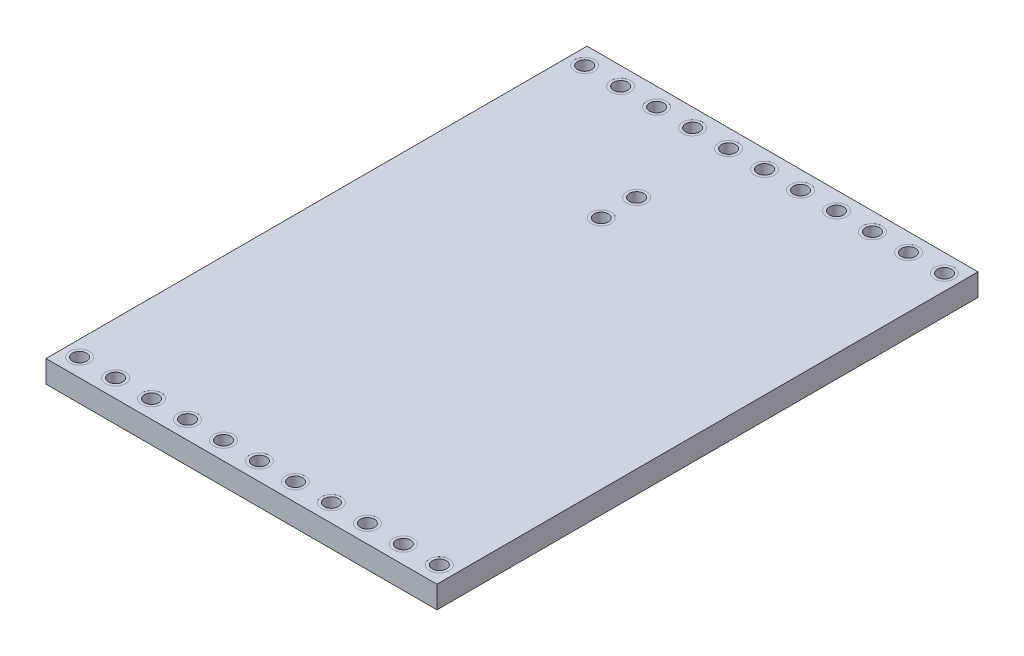
from build123d import *

# Parameters (mm, degrees)
BASES_W                           = 27.6
BASES_H                           = 38.2
BASE_DEPTH                        = 0.785
F_1_0_1_DIAMETER_HOLE1_D          = 1
SOLDERACCESSCUTS_R                = 0.7
SOLDERACCESSCUT_DEPTH             = 0.001
HOLESACHORZLP_COUNT               = 11
HOLESACHORZLP_PITCH               = 2.54
HOLESACHORZLP_COPY_1_SKETCH_R     = 0.7
HOLESACHORZLP_COPY_1_DEPTH        = 0.001
HOLESACHORZLP_COPY_2_SKETCH_R     = 0.7
HOLESACHORZLP_COPY_2_DEPTH        = 0.001
HOLESACHORZLP_COPY_3_SKETCH_R     = 0.7
HOLESACHORZLP_COPY_3_DEPTH        = 0.001
HOLESACHORZLP_COPY_4_SKETCH_R     = 0.7
HOLESACHORZLP_COPY_4_DEPTH        = 0.001
HOLESACHORZLP_COPY_5_SKETCH_R     = 0.7
HOLESACHORZLP_COPY_5_DEPTH        = 0.001
HOLESACHORZLP_COPY_6_SKETCH_R     = 0.7
HOLESACHORZLP_COPY_6_DEPTH        = 0.001
HOLESACHORZLP_COPY_7_SKETCH_R     = 0.7
HOLESACHORZLP_COPY_7_DEPTH        = 0.001
HOLESACHORZLP_COPY_8_SKETCH_R     = 0.7
HOLESACHORZLP_COPY_8_DEPTH        = 0.001
HOLESACHORZLP_COPY_9_SKETCH_R     = 0.7
HOLESACHORZLP_COPY_9_DEPTH        = 0.001
HOLESACHORZLP_COPY_10_SKETCH_R    = 0.7
HOLESACHORZLP_COPY_10_DEPTH       = 0.001
MIRROR1_COPY_1_SKETCH_R           = 0.7
MIRROR1_COPY_1_DEPTH              = 0.001
MIRROR1_COPY_2_D                  = 1
MIRROR1_COPY_3_D                  = 1
MIRROR1_COPY_4_D                  = 1
MIRROR1_COPY_5_D                  = 1
MIRROR1_COPY_6_D                  = 1
MIRROR1_COPY_7_D                  = 1
MIRROR1_COPY_8_D                  = 1
MIRROR1_COPY_9_D                  = 1
MIRROR1_COPY_10_D                 = 1
MIRROR1_COPY_11_D                 = 1
MIRROR1_COPY_12_SKETCH_R          = 0.7
MIRROR1_COPY_12_DEPTH             = 0.001
MIRROR1_COPY_13_SKETCH_R          = 0.7
MIRROR1_COPY_13_DEPTH             = 0.001
MIRROR1_COPY_14_SKETCH_R          = 0.7
MIRROR1_COPY_14_DEPTH             = 0.001
MIRROR1_COPY_15_SKETCH_R          = 0.7
MIRROR1_COPY_15_DEPTH             = 0.001
MIRROR1_COPY_16_SKETCH_R          = 0.7
MIRROR1_COPY_16_DEPTH             = 0.001
MIRROR1_COPY_17_SKETCH_R          = 0.7
MIRROR1_COPY_17_DEPTH             = 0.001
MIRROR1_COPY_18_SKETCH_R          = 0.7
MIRROR1_COPY_18_DEPTH             = 0.001
MIRROR1_COPY_19_SKETCH_R          = 0.7
MIRROR1_COPY_19_DEPTH             = 0.001
MIRROR1_COPY_20_SKETCH_R          = 0.7
MIRROR1_COPY_20_DEPTH             = 0.001
MIRROR1_COPY_21_SKETCH_R          = 0.7
MIRROR1_COPY_21_DEPTH             = 0.001
MIRROR1_COPY_22_SKETCH_R          = 0.7
MIRROR1_COPY_22_DEPTH             = 0.001
MIRROR1_COPY_23_SKETCH_R          = 0.7
MIRROR1_COPY_23_DEPTH             = 0.001
MIRROR1_COPY_24_SKETCH_R          = 0.7
MIRROR1_COPY_24_DEPTH             = 0.001
MIRROR1_COPY_25_SKETCH_R          = 0.7
MIRROR1_COPY_25_DEPTH             = 0.001
MIRROR1_COPY_26_SKETCH_R          = 0.7
MIRROR1_COPY_26_DEPTH             = 0.001
MIRROR1_COPY_27_SKETCH_R          = 0.7
MIRROR1_COPY_27_DEPTH             = 0.001
MIRROR1_COPY_28_SKETCH_R          = 0.7
MIRROR1_COPY_28_DEPTH             = 0.001
MIRROR1_COPY_29_SKETCH_R          = 0.7
MIRROR1_COPY_29_DEPTH             = 0.001
MIRROR1_COPY_30_SKETCH_R          = 0.7
MIRROR1_COPY_30_DEPTH             = 0.001
MIRROR1_COPY_31_SKETCH_R          = 0.7
MIRROR1_COPY_31_DEPTH             = 0.001
F_1_0_1_DIAMETER_HOLE2_D          = 1
SOLDERACCESSCUTFORCAPACITOR_START = -0.001
SOLDERACCESSCUTFORCAPACITORS_R    = 0.7
SOLDERACCESSCUTFORCAPACITORS_R_2  = 0.5
SOLDERACCESSCUTFORCAPACITOR_DEPTH = 0.001


with BuildPart() as part:
    # BaseS → Base (new, symmetric)
    with BuildSketch(Plane(origin=(0, 0, 0), x_dir=(1, 0, 0), z_dir=(0, 1, 0))):
        Rectangle(BASES_W, BASES_H)
    extrude(amount=BASE_DEPTH, both=True)

    # Ø1.0 (1) Diameter Hole1 (through all)
    with Locations(Plane(origin=(0, 0.785, 0), x_dir=(1, 0, 0), z_dir=(0, 1, 0))):
        with Locations((-12.7, -17.83)):
            f_1_0_1_diameter_hole1 = Hole(F_1_0_1_DIAMETER_HOLE1_D / 2)

    # SolderAccessCutS → SolderAccessCut (cut)
    with BuildSketch(Plane(origin=(0, 0.785, 0), x_dir=(1, 0, 0), z_dir=(0, 1, 0))):
        with Locations(Location((-12.7, -17.83, 0), (0, 0, 270))):
            Circle(SOLDERACCESSCUTS_R)
    solderaccesscut = extrude(amount=-SOLDERACCESSCUT_DEPTH, mode=Mode.SUBTRACT)

    # SACVM: SolderAccessCut across plane
    add(solderaccesscut.mirror(Plane.ZX), mode=Mode.SUBTRACT)

    # HoleSACHorzLP: Ø1.0 (1) Diameter Hole1, SolderAccessCut ×11
    with Locations(*[(i * HOLESACHORZLP_PITCH, 0, 0) for i in range(1, HOLESACHORZLP_COUNT)]):
        add(f_1_0_1_diameter_hole1, mode=Mode.SUBTRACT)
        add(solderaccesscut, mode=Mode.SUBTRACT)

    # HoleSACHorzLP copy 1 sketch → HoleSACHorzLP copy 1 (cut)
    with BuildSketch(Plane(origin=(2.54, -0.785, 0), x_dir=(1, 0, 0), z_dir=(0, -1, 0))):
        with Locations((-12.7, 17.83)):
            Circle(HOLESACHORZLP_COPY_1_SKETCH_R)
    extrude(amount=-HOLESACHORZLP_COPY_1_DEPTH, mode=Mode.SUBTRACT)

    # HoleSACHorzLP copy 2 sketch → HoleSACHorzLP copy 2 (cut)
    with BuildSketch(Plane(origin=(5.08, -0.785, 0), x_dir=(1, 0, 0), z_dir=(0, -1, 0))):
        with Locations((-12.7, 17.83)):
            Circle(HOLESACHORZLP_COPY_2_SKETCH_R)
    extrude(amount=-HOLESACHORZLP_COPY_2_DEPTH, mode=Mode.SUBTRACT)

    # HoleSACHorzLP copy 3 sketch → HoleSACHorzLP copy 3 (cut)
    with BuildSketch(Plane(origin=(7.62, -0.785, 0), x_dir=(1, 0, 0), z_dir=(0, -1, 0))):
        with Locations((-12.7, 17.83)):
            Circle(HOLESACHORZLP_COPY_3_SKETCH_R)
    extrude(amount=-HOLESACHORZLP_COPY_3_DEPTH, mode=Mode.SUBTRACT)

    # HoleSACHorzLP copy 4 sketch → HoleSACHorzLP copy 4 (cut)
    with BuildSketch(Plane(origin=(10.16, -0.785, 0), x_dir=(1, 0, 0), z_dir=(0, -1, 0))):
        with Locations((-12.7, 17.83)):
            Circle(HOLESACHORZLP_COPY_4_SKETCH_R)
    extrude(amount=-HOLESACHORZLP_COPY_4_DEPTH, mode=Mode.SUBTRACT)

    # HoleSACHorzLP copy 5 sketch → HoleSACHorzLP copy 5 (cut)
    with BuildSketch(Plane(origin=(12.7, -0.785, 0), x_dir=(1, 0, 0), z_dir=(0, -1, 0))):
        with Locations((-12.7, 17.83)):
            Circle(HOLESACHORZLP_COPY_5_SKETCH_R)
    extrude(amount=-HOLESACHORZLP_COPY_5_DEPTH, mode=Mode.SUBTRACT)

    # HoleSACHorzLP copy 6 sketch → HoleSACHorzLP copy 6 (cut)
    with BuildSketch(Plane(origin=(15.24, -0.785, 0), x_dir=(1, 0, 0), z_dir=(0, -1, 0))):
        with Locations((-12.7, 17.83)):
            Circle(HOLESACHORZLP_COPY_6_SKETCH_R)
    extrude(amount=-HOLESACHORZLP_COPY_6_DEPTH, mode=Mode.SUBTRACT)

    # HoleSACHorzLP copy 7 sketch → HoleSACHorzLP copy 7 (cut)
    with BuildSketch(Plane(origin=(17.78, -0.785, 0), x_dir=(1, 0, 0), z_dir=(0, -1, 0))):
        with Locations((-12.7, 17.83)):
            Circle(HOLESACHORZLP_COPY_7_SKETCH_R)
    extrude(amount=-HOLESACHORZLP_COPY_7_DEPTH, mode=Mode.SUBTRACT)

    # HoleSACHorzLP copy 8 sketch → HoleSACHorzLP copy 8 (cut)
    with BuildSketch(Plane(origin=(20.32, -0.785, 0), x_dir=(1, 0, 0), z_dir=(0, -1, 0))):
        with Locations((-12.7, 17.83)):
            Circle(HOLESACHORZLP_COPY_8_SKETCH_R)
    extrude(amount=-HOLESACHORZLP_COPY_8_DEPTH, mode=Mode.SUBTRACT)

    # HoleSACHorzLP copy 9 sketch → HoleSACHorzLP copy 9 (cut)
    with BuildSketch(Plane(origin=(22.86, -0.785, 0), x_dir=(1, 0, 0), z_dir=(0, -1, 0))):
        with Locations((-12.7, 17.83)):
            Circle(HOLESACHORZLP_COPY_9_SKETCH_R)
    extrude(amount=-HOLESACHORZLP_COPY_9_DEPTH, mode=Mode.SUBTRACT)

    # HoleSACHorzLP copy 10 sketch → HoleSACHorzLP copy 10 (cut)
    with BuildSketch(Plane(origin=(25.4, -0.785, 0), x_dir=(1, 0, 0), z_dir=(0, -1, 0))):
        with Locations((-12.7, 17.83)):
            Circle(HOLESACHORZLP_COPY_10_SKETCH_R)
    extrude(amount=-HOLESACHORZLP_COPY_10_DEPTH, mode=Mode.SUBTRACT)

    # Mirror1: Ø1.0 (1) Diameter Hole1, SolderAccessCut across plane
    add(f_1_0_1_diameter_hole1.mirror(Plane.XY), mode=Mode.SUBTRACT)
    add(solderaccesscut.mirror(Plane.XY), mode=Mode.SUBTRACT)

    # Mirror1 copy 1 sketch → Mirror1 copy 1 (cut)
    with BuildSketch(Plane.XZ.offset(0.785)):
        with Locations(Location((-12.7, -17.83, 0), (0, 0, 270))):
            Circle(MIRROR1_COPY_1_SKETCH_R)
    extrude(amount=-MIRROR1_COPY_1_DEPTH, mode=Mode.SUBTRACT)

    # Mirror1 copy 2 (through all)
    with Locations(Plane(origin=(2.54, 0.785, 0), x_dir=(1, 0, 0), z_dir=(0, 1, 0))):
        with Locations((-12.7, 17.83)):
            Hole(MIRROR1_COPY_2_D / 2)

    # Mirror1 copy 3 (through all)
    with Locations(Plane(origin=(5.08, 0.785, 0), x_dir=(1, 0, 0), z_dir=(0, 1, 0))):
        with Locations((-12.7, 17.83)):
            Hole(MIRROR1_COPY_3_D / 2)

    # Mirror1 copy 4 (through all)
    with Locations(Plane(origin=(7.62, 0.785, 0), x_dir=(1, 0, 0), z_dir=(0, 1, 0))):
        with Locations((-12.7, 17.83)):
            Hole(MIRROR1_COPY_4_D / 2)

    # Mirror1 copy 5 (through all)
    with Locations(Plane(origin=(10.16, 0.785, 0), x_dir=(1, 0, 0), z_dir=(0, 1, 0))):
        with Locations((-12.7, 17.83)):
            Hole(MIRROR1_COPY_5_D / 2)

    # Mirror1 copy 6 (through all)
    with Locations(Plane(origin=(12.7, 0.785, 0), x_dir=(1, 0, 0), z_dir=(0, 1, 0))):
        with Locations((-12.7, 17.83)):
            Hole(MIRROR1_COPY_6_D / 2)

    # Mirror1 copy 7 (through all)
    with Locations(Plane(origin=(15.24, 0.785, 0), x_dir=(1, 0, 0), z_dir=(0, 1, 0))):
        with Locations((-12.7, 17.83)):
            Hole(MIRROR1_COPY_7_D / 2)

    # Mirror1 copy 8 (through all)
    with Locations(Plane(origin=(17.78, 0.785, 0), x_dir=(1, 0, 0), z_dir=(0, 1, 0))):
        with Locations((-12.7, 17.83)):
            Hole(MIRROR1_COPY_8_D / 2)

    # Mirror1 copy 9 (through all)
    with Locations(Plane(origin=(20.32, 0.785, 0), x_dir=(1, 0, 0), z_dir=(0, 1, 0))):
        with Locations((-12.7, 17.83)):
            Hole(MIRROR1_COPY_9_D / 2)

    # Mirror1 copy 10 (through all)
    with Locations(Plane(origin=(22.86, 0.785, 0), x_dir=(1, 0, 0), z_dir=(0, 1, 0))):
        with Locations((-12.7, 17.83)):
            Hole(MIRROR1_COPY_10_D / 2)

    # Mirror1 copy 11 (through all)
    with Locations(Plane(origin=(25.4, 0.785, 0), x_dir=(1, 0, 0), z_dir=(0, 1, 0))):
        with Locations((-12.7, 17.83)):
            Hole(MIRROR1_COPY_11_D / 2)

    # Mirror1 copy 12 sketch → Mirror1 copy 12 (cut)
    with BuildSketch(Plane(origin=(2.54, 0.785, 0), x_dir=(1, 0, 0), z_dir=(0, 1, 0))):
        with Locations((-12.7, 17.83)):
            Circle(MIRROR1_COPY_12_SKETCH_R)
    extrude(amount=-MIRROR1_COPY_12_DEPTH, mode=Mode.SUBTRACT)

    # Mirror1 copy 13 sketch → Mirror1 copy 13 (cut)
    with BuildSketch(Plane(origin=(5.08, 0.785, 0), x_dir=(1, 0, 0), z_dir=(0, 1, 0))):
        with Locations((-12.7, 17.83)):
            Circle(MIRROR1_COPY_13_SKETCH_R)
    extrude(amount=-MIRROR1_COPY_13_DEPTH, mode=Mode.SUBTRACT)

    # Mirror1 copy 14 sketch → Mirror1 copy 14 (cut)
    with BuildSketch(Plane(origin=(7.62, 0.785, 0), x_dir=(1, 0, 0), z_dir=(0, 1, 0))):
        with Locations((-12.7, 17.83)):
            Circle(MIRROR1_COPY_14_SKETCH_R)
    extrude(amount=-MIRROR1_COPY_14_DEPTH, mode=Mode.SUBTRACT)

    # Mirror1 copy 15 sketch → Mirror1 copy 15 (cut)
    with BuildSketch(Plane(origin=(10.16, 0.785, 0), x_dir=(1, 0, 0), z_dir=(0, 1, 0))):
        with Locations((-12.7, 17.83)):
            Circle(MIRROR1_COPY_15_SKETCH_R)
    extrude(amount=-MIRROR1_COPY_15_DEPTH, mode=Mode.SUBTRACT)

    # Mirror1 copy 16 sketch → Mirror1 copy 16 (cut)
    with BuildSketch(Plane(origin=(12.7, 0.785, 0), x_dir=(1, 0, 0), z_dir=(0, 1, 0))):
        with Locations((-12.7, 17.83)):
            Circle(MIRROR1_COPY_16_SKETCH_R)
    extrude(amount=-MIRROR1_COPY_16_DEPTH, mode=Mode.SUBTRACT)

    # Mirror1 copy 17 sketch → Mirror1 copy 17 (cut)
    with BuildSketch(Plane(origin=(15.24, 0.785, 0), x_dir=(1, 0, 0), z_dir=(0, 1, 0))):
        with Locations((-12.7, 17.83)):
            Circle(MIRROR1_COPY_17_SKETCH_R)
    extrude(amount=-MIRROR1_COPY_17_DEPTH, mode=Mode.SUBTRACT)

    # Mirror1 copy 18 sketch → Mirror1 copy 18 (cut)
    with BuildSketch(Plane(origin=(17.78, 0.785, 0), x_dir=(1, 0, 0), z_dir=(0, 1, 0))):
        with Locations((-12.7, 17.83)):
            Circle(MIRROR1_COPY_18_SKETCH_R)
    extrude(amount=-MIRROR1_COPY_18_DEPTH, mode=Mode.SUBTRACT)

    # Mirror1 copy 19 sketch → Mirror1 copy 19 (cut)
    with BuildSketch(Plane(origin=(20.32, 0.785, 0), x_dir=(1, 0, 0), z_dir=(0, 1, 0))):
        with Locations((-12.7, 17.83)):
            Circle(MIRROR1_COPY_19_SKETCH_R)
    extrude(amount=-MIRROR1_COPY_19_DEPTH, mode=Mode.SUBTRACT)

    # Mirror1 copy 20 sketch → Mirror1 copy 20 (cut)
    with BuildSketch(Plane(origin=(22.86, 0.785, 0), x_dir=(1, 0, 0), z_dir=(0, 1, 0))):
        with Locations((-12.7, 17.83)):
            Circle(MIRROR1_COPY_20_SKETCH_R)
    extrude(amount=-MIRROR1_COPY_20_DEPTH, mode=Mode.SUBTRACT)

    # Mirror1 copy 21 sketch → Mirror1 copy 21 (cut)
    with BuildSketch(Plane(origin=(25.4, 0.785, 0), x_dir=(1, 0, 0), z_dir=(0, 1, 0))):
        with Locations((-12.7, 17.83)):
            Circle(MIRROR1_COPY_21_SKETCH_R)
    extrude(amount=-MIRROR1_COPY_21_DEPTH, mode=Mode.SUBTRACT)

    # Mirror1 copy 22 sketch → Mirror1 copy 22 (cut)
    with BuildSketch(Plane(origin=(2.54, -0.785, 0), x_dir=(1, 0, 0), z_dir=(0, -1, 0))):
        with Locations(Location((-12.7, -17.83, 0), (0, 0, 270))):
            Circle(MIRROR1_COPY_22_SKETCH_R)
    extrude(amount=-MIRROR1_COPY_22_DEPTH, mode=Mode.SUBTRACT)

    # Mirror1 copy 23 sketch → Mirror1 copy 23 (cut)
    with BuildSketch(Plane(origin=(5.08, -0.785, 0), x_dir=(1, 0, 0), z_dir=(0, -1, 0))):
        with Locations(Location((-12.7, -17.83, 0), (0, 0, 270))):
            Circle(MIRROR1_COPY_23_SKETCH_R)
    extrude(amount=-MIRROR1_COPY_23_DEPTH, mode=Mode.SUBTRACT)

    # Mirror1 copy 24 sketch → Mirror1 copy 24 (cut)
    with BuildSketch(Plane(origin=(7.62, -0.785, 0), x_dir=(1, 0, 0), z_dir=(0, -1, 0))):
        with Locations(Location((-12.7, -17.83, 0), (0, 0, 270))):
            Circle(MIRROR1_COPY_24_SKETCH_R)
    extrude(amount=-MIRROR1_COPY_24_DEPTH, mode=Mode.SUBTRACT)

    # Mirror1 copy 25 sketch → Mirror1 copy 25 (cut)
    with BuildSketch(Plane(origin=(10.16, -0.785, 0), x_dir=(1, 0, 0), z_dir=(0, -1, 0))):
        with Locations(Location((-12.7, -17.83, 0), (0, 0, 270))):
            Circle(MIRROR1_COPY_25_SKETCH_R)
    extrude(amount=-MIRROR1_COPY_25_DEPTH, mode=Mode.SUBTRACT)

    # Mirror1 copy 26 sketch → Mirror1 copy 26 (cut)
    with BuildSketch(Plane(origin=(12.7, -0.785, 0), x_dir=(1, 0, 0), z_dir=(0, -1, 0))):
        with Locations(Location((-12.7, -17.83, 0), (0, 0, 270))):
            Circle(MIRROR1_COPY_26_SKETCH_R)
    extrude(amount=-MIRROR1_COPY_26_DEPTH, mode=Mode.SUBTRACT)

    # Mirror1 copy 27 sketch → Mirror1 copy 27 (cut)
    with BuildSketch(Plane(origin=(15.24, -0.785, 0), x_dir=(1, 0, 0), z_dir=(0, -1, 0))):
        with Locations(Location((-12.7, -17.83, 0), (0, 0, 270))):
            Circle(MIRROR1_COPY_27_SKETCH_R)
    extrude(amount=-MIRROR1_COPY_27_DEPTH, mode=Mode.SUBTRACT)

    # Mirror1 copy 28 sketch → Mirror1 copy 28 (cut)
    with BuildSketch(Plane(origin=(17.78, -0.785, 0), x_dir=(1, 0, 0), z_dir=(0, -1, 0))):
        with Locations(Location((-12.7, -17.83, 0), (0, 0, 270))):
            Circle(MIRROR1_COPY_28_SKETCH_R)
    extrude(amount=-MIRROR1_COPY_28_DEPTH, mode=Mode.SUBTRACT)

    # Mirror1 copy 29 sketch → Mirror1 copy 29 (cut)
    with BuildSketch(Plane(origin=(20.32, -0.785, 0), x_dir=(1, 0, 0), z_dir=(0, -1, 0))):
        with Locations(Location((-12.7, -17.83, 0), (0, 0, 270))):
            Circle(MIRROR1_COPY_29_SKETCH_R)
    extrude(amount=-MIRROR1_COPY_29_DEPTH, mode=Mode.SUBTRACT)

    # Mirror1 copy 30 sketch → Mirror1 copy 30 (cut)
    with BuildSketch(Plane(origin=(22.86, -0.785, 0), x_dir=(1, 0, 0), z_dir=(0, -1, 0))):
        with Locations(Location((-12.7, -17.83, 0), (0, 0, 270))):
            Circle(MIRROR1_COPY_30_SKETCH_R)
    extrude(amount=-MIRROR1_COPY_30_DEPTH, mode=Mode.SUBTRACT)

    # Mirror1 copy 31 sketch → Mirror1 copy 31 (cut)
    with BuildSketch(Plane(origin=(25.4, -0.785, 0), x_dir=(1, 0, 0), z_dir=(0, -1, 0))):
        with Locations(Location((-12.7, -17.83, 0), (0, 0, 270))):
            Circle(MIRROR1_COPY_31_SKETCH_R)
    extrude(amount=-MIRROR1_COPY_31_DEPTH, mode=Mode.SUBTRACT)

    # Ø1.0 (1) Diameter Hole2 (through all)
    with Locations(Plane(origin=(0, 0.785, 0), x_dir=(1, 0, 0), z_dir=(0, 1, 0))):
        with Locations((-2.8, 11.6), (-2.8, 9.1)):
            Hole(F_1_0_1_DIAMETER_HOLE2_D / 2)

    # SolderAccessCutforCapacitorS → SolderAccessCutforCapacitor (cut)
    # profile 1 of 2: a face of its own
    with BuildSketch(Plane(origin=(0, 0.785, 0), x_dir=(1, 0, 0), z_dir=(0, 1, 0)).offset(SOLDERACCESSCUTFORCAPACITOR_START)):
        with Locations(Location((-2.8, 11.6, 0), (0, 0, 270))):
            Circle(SOLDERACCESSCUTFORCAPACITORS_R)
        with Locations(Location((-2.8, 11.6, 0), (0, 0, 270))):
            Circle(SOLDERACCESSCUTFORCAPACITORS_R_2, mode=Mode.SUBTRACT)
    # profile 2 of 2: a face of its own
    with BuildSketch(Plane(origin=(0, 0.785, 0), x_dir=(1, 0, 0), z_dir=(0, 1, 0)).offset(SOLDERACCESSCUTFORCAPACITOR_START)):
        with Locations(Location((-2.8, 9.1, 0), (0, 0, 270))):
            Circle(SOLDERACCESSCUTFORCAPACITORS_R)
        with Locations(Location((-2.8, 9.1, 0), (0, 0, 270))):
            Circle(SOLDERACCESSCUTFORCAPACITORS_R_2, mode=Mode.SUBTRACT)
    solderaccesscutforcapacitor = extrude(amount=SOLDERACCESSCUTFORCAPACITOR_DEPTH, mode=Mode.SUBTRACT)

    # SACCVM: SolderAccessCutforCapacitor across plane
    add(solderaccesscutforcapacitor.mirror(Plane.ZX), mode=Mode.SUBTRACT)


solid = part.part
